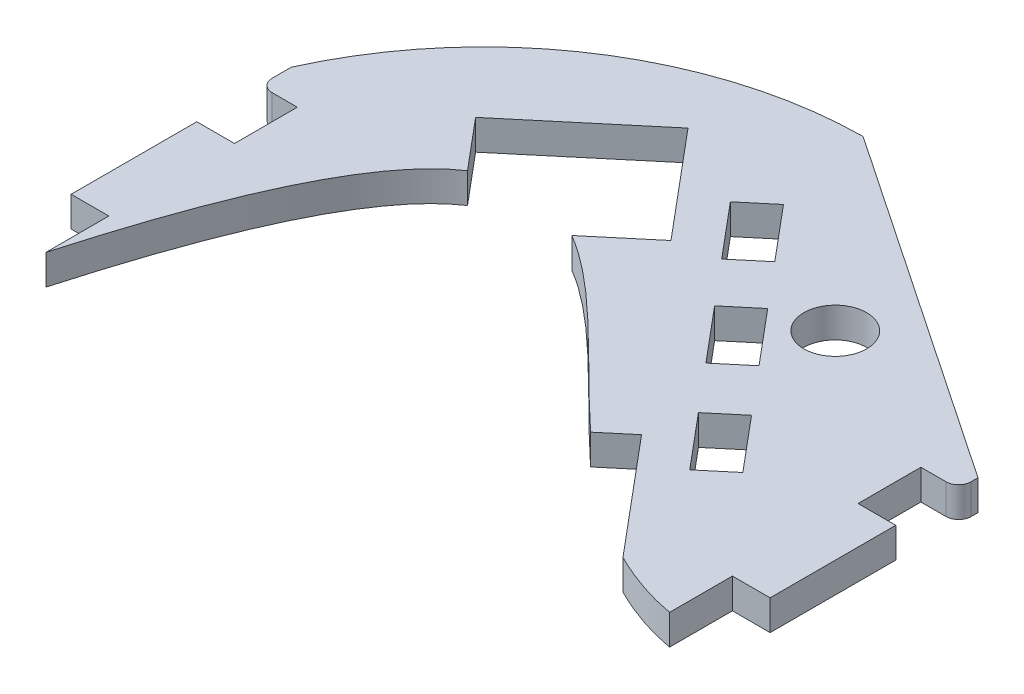
from build123d import *

# Parameters (mm, degrees)
CROQUIS1_R                 = 30.5
SALIENTE_EXTRUIR1_DEPTH    = 2.4
CROQUIS2_R                 = 2
CORTAR_EXTRUIR1_DEPTH      = 4
CORTAR_EXTRUIR3_START      = -4
CORTAR_EXTRUIR3_DEPTH      = 4
CORTAR_EXTRUIR5_START      = -4
CORTAR_EXTRUIR5_DEPTH      = 4
CORTAR_EXTRUIR6_DEPTH      = 10
CROQUIS10_R                = 2.5
CORTAR_EXTRUIR7_DEPTH      = 3
CORTAR_EXTRUIR8_DEPTH      = 44.200231628
CORTAR_EXTRUIR8_DEPTH_BACK = 44.200231628
CORTAR_EXTRUIR9_START      = -10
CORTAR_EXTRUIR9_DEPTH      = 10
REDONDEO1_R                = 1
CORTAR_EXTRUIR10_DEPTH     = 3


with BuildPart() as part:
    # Croquis1 → Saliente-Extruir1 (new body)
    with BuildSketch(Plane(origin=(0, 0, 0), x_dir=(1, 0, 0), z_dir=(0, 1, 0))):
        with Locations(Location((0, 0, 0), (0, 0, 270))):
            Circle(CROQUIS1_R)
    extrude(amount=SALIENTE_EXTRUIR1_DEPTH)

    # Croquis2 → Cortar-Extruir1 (cut)
    with BuildSketch(Plane(origin=(0, 2.4, 0), x_dir=(1, 0, 0), z_dir=(0, 1, 0))):
        with Locations(Location((0, 0, 0), (0, 0, 270))):
            Circle(CROQUIS2_R)
    extrude(amount=-CORTAR_EXTRUIR1_DEPTH, mode=Mode.SUBTRACT)

    # Croquis5 → Cortar-Extruir3 (cut)
    with BuildSketch(Plane(origin=(0, 2.4, 0), x_dir=(1, 0, 0), z_dir=(0, 1, 0)).offset(CORTAR_EXTRUIR3_START)):
        with BuildLine():
            Line((28.814059068, 5), (30.087372767, 5))
            ThreePointArc((30.087372767, 5), (29.556634924, 7.526973624), (28.814059068, 10))
            Line((28.814059068, 10), (24.814059068, 10))
            Line((24.814059068, 10), (24.814059068, 5))
            Line((24.814059068, 5), (28.814059068, 5))
        make_face()
        with BuildLine():
            Line((30.087372767, -5), (28.814059068, -5))
            Line((28.814059068, -5), (24.814059068, -5))
            Line((24.814059068, -5), (24.814059068, -10))
            Line((24.814059068, -10), (28.814059068, -10))
            ThreePointArc((28.814059068, -10), (29.556634924, -7.526973624), (30.087372767, -5))
        make_face()
        with BuildLine():
            Line((-24.814059068, 5), (-24.814059068, 10))
            Line((-24.814059068, 10), (-28.814059068, 10))
            ThreePointArc((-28.814059068, 10), (-29.556634924, 7.526973624), (-30.087372767, 5))
            Line((-30.087372767, 5), (-28.814059068, 5))
            Line((-28.814059068, 5), (-24.814059068, 5))
        make_face()
        with BuildLine():
            Line((-28.814059068, -10), (-24.814059068, -10))
            Line((-24.814059068, -10), (-24.814059068, -5))
            Line((-24.814059068, -5), (-28.814059068, -5))
            Line((-28.814059068, -5), (-30.087372767, -5))
            ThreePointArc((-30.087372767, -5), (-29.556634924, -7.526973624), (-28.814059068, -10))
        make_face()
    extrude(amount=CORTAR_EXTRUIR3_DEPTH, mode=Mode.SUBTRACT)

    # Croquis7 → Cortar-Extruir5 (cut)
    with BuildSketch(Plane(origin=(0, 2.4, 0), x_dir=(1, 0, 0), z_dir=(0, 1, 0)).offset(CORTAR_EXTRUIR5_START)):
        Polygon((1.428390211, 22.411430151), (-0.869743118, 20.483067322), (2.34419493, 16.652845106), (4.642328259, 18.581207935), align=None)
        with BuildLine():
            Line((-24.814059068, -10), (-28.814059068, -10))
            ThreePointArc((-28.814059068, -10), (0, -30.5), (28.814059068, -10))
            Line((28.814059068, -10), (24.814059068, -10))
            add(Edge.make_bspline(
                [(24.814059068, -10), (22.863263717, -9.657344338), (20.984021298, -8.980450277), (19.168992989, -8.065339906)],
                knots=[0, 0, 0, 0, 0.087850084, 0.087850084, 0.087850084, 0.087850084], degree=3))
            Line((19.168992989, -8.065339906), (11.455541673, 1.127193412))
            Line((11.455541673, 1.127193412), (9.248678515, -0.72458465))
            add(Edge.make_bspline(
                [(9.248678515, -0.72458465), (4.033234859, 4.116641048), (-0.646914404, 9.508508747), (-5.04935939, 12.080675515)],
                knots=[0.258799312, 0.258799312, 0.258799312, 0.258799312, 0.546435258, 0.546435258, 0.546435258, 0.546435258], degree=3))
            Line((-5.04935939, 12.080675515), (-0.757422911, 15.682037831))
            Line((-0.757422911, 15.682037831), (-7.828086618, 24.108526705))
            Line((-7.828086618, 24.108526705), (-17.020619935, 16.395075389))
            Line((-17.020619935, 16.395075389), (-13.66601447, 12.397212273))
            add(Edge.make_bspline(
                [(-13.66601447, 12.397212273), (-17.403465693, 9.897923685), (-21.056529869, 3.255841362), (-24.814059068, -10)],
                knots=[0.740637404, 0.740637404, 0.740637404, 0.740637404, 1, 1, 1, 1], degree=3))
        make_face()
        Polygon((14.685884661, 6.611763511), (12.387751331, 4.683400682), (15.60168938, 0.853178467), (17.899822709, 2.781541296), align=None)
    extrude(amount=CORTAR_EXTRUIR5_DEPTH, mode=Mode.SUBTRACT)

    # Croquis9 → Cortar-Extruir6 (cut)
    with BuildSketch(Plane(origin=(0, 2.4, 0), x_dir=(1, 0, 0), z_dir=(0, 1, 0))):
        Polygon((7.971418181, 14.613753061), (5.673284852, 12.685390231), (8.887222901, 8.855168016), (11.18535623, 10.783530845), align=None)
    extrude(amount=-CORTAR_EXTRUIR6_DEPTH, mode=Mode.SUBTRACT)

    # Croquis10 → Cortar-Extruir7 (cut)
    with BuildSketch(Plane(origin=(0, 2.4, 0), x_dir=(1, 0, 0), z_dir=(0, 1, 0))):
        with Locations(Location((12, 16, 0), (0, 0, 270))):
            Circle(CROQUIS10_R)
    extrude(amount=-CORTAR_EXTRUIR7_DEPTH, mode=Mode.SUBTRACT)

    # Croquis11 → Cortar-Extruir8 (cut, two sides: drawn at the far end of the back side and taken through both)
    with BuildSketch(Plane(origin=(0, 2.4, 0), x_dir=(1, 0, 0), z_dir=(0, 1, 0)).offset(-CORTAR_EXTRUIR8_DEPTH_BACK)):
        with BuildLine():
            Line((30.087372767, 5), (27.814059068, 5))
            Line((27.814059068, 5), (27.814059068, -5))
            Line((27.814059068, -5), (30.087372767, -5))
            ThreePointArc((30.087372767, -5), (30.5, 0), (30.087372767, 5))
        make_face()
        with BuildLine():
            ThreePointArc((28.814059068, 10), (28.341972277, 11.268655974), (27.814059068, 12.515115586))
            Line((27.814059068, 12.515115586), (27.814059068, 10))
            Line((27.814059068, 10), (28.814059068, 10))
        make_face()
        with BuildLine():
            Line((-27.814059068, -5), (-27.814059068, 5))
            Line((-27.814059068, 5), (-30.087372767, 5))
            ThreePointArc((-30.087372767, 5), (-30.5, 0), (-30.087372767, -5))
            Line((-30.087372767, -5), (-27.814059068, -5))
        make_face()
        with BuildLine():
            Line((-28.814059068, 10), (-27.814059068, 10))
            Line((-27.814059068, 10), (-27.814059068, 12.515115586))
            ThreePointArc((-27.814059068, 12.515115586), (-28.341972277, 11.268655974), (-28.814059068, 10))
        make_face()
    extrude(amount=CORTAR_EXTRUIR8_DEPTH + CORTAR_EXTRUIR8_DEPTH_BACK, mode=Mode.SUBTRACT)

    # Croquis12 → Cortar-Extruir9 (cut)
    with BuildSketch(Plane(origin=(0, 2.4, 0), x_dir=(1, 0, 0), z_dir=(0, 1, 0)).offset(CORTAR_EXTRUIR9_START)):
        with BuildLine():
            Line((-0.28585192, 30.498660441), (27.814059068, 11.545031156))
            Line((27.814059068, 11.545031156), (27.814059068, 12.515115586))
            ThreePointArc((27.814059068, 12.515115586), (16.440879495, 25.689442995), (-0.28585192, 30.498660441))
        make_face()
    extrude(amount=CORTAR_EXTRUIR9_DEPTH, mode=Mode.SUBTRACT)

    # Redondeo1
    redondeo1_edges = [part.edges().sort_by_distance(p)[0] for p in [
        (27.814059068, 1.2, -10),
        (-27.814059068, 1.2, -10),
    ]]
    fillet(redondeo1_edges, radius=REDONDEO1_R)

    # Croquis13 → Cortar-Extruir10 (cut)
    with BuildSketch(Plane(origin=(0, 2.4, 0), x_dir=(1, 0, 0), z_dir=(0, 1, 0))):
        Polygon((1.428390211, 22.411430151), (-0.869743118, 20.483067322), (-1.062579401, 20.712880655), (1.235553928, 22.641243484), align=None)
        Polygon((2.34419493, 16.652845106), (4.642328259, 18.581207935), (4.835164542, 18.351394602), (2.537031213, 16.423031773), align=None)
        Polygon((7.971418181, 14.613753061), (5.673284852, 12.685390231), (5.480448569, 12.915203564), (7.778581899, 14.843566393), align=None)
        Polygon((8.887222901, 8.855168016), (11.18535623, 10.783530845), (11.378192513, 10.553717512), (9.080059183, 8.625354683), align=None)
        Polygon((14.685884661, 6.611763511), (12.387751331, 4.683400682), (12.194915048, 4.913214015), (14.493048378, 6.841576844), align=None)
        Polygon((17.899822709, 2.781541296), (15.60168938, 0.853178467), (15.794525663, 0.623365134), (18.092658992, 2.551727963), align=None)
    extrude(amount=-CORTAR_EXTRUIR10_DEPTH, mode=Mode.SUBTRACT)


solid = part.part
